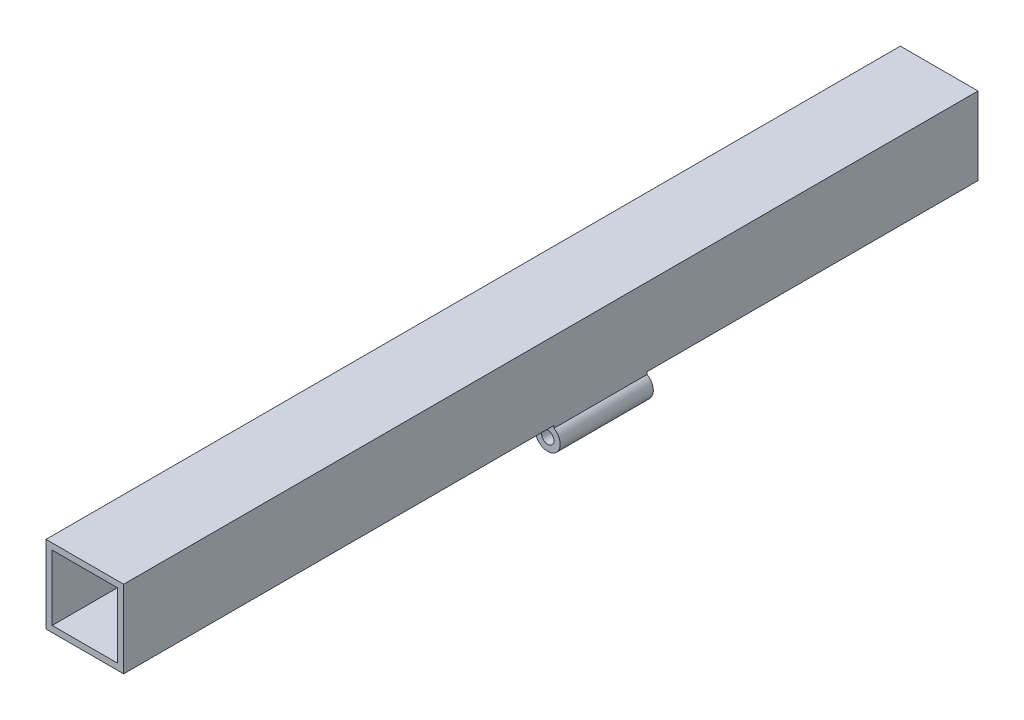
from build123d import *

# Parameters (mm, degrees)
SKETCH1_W           = 25
SKETCH1_H           = 25
SKETCH1_W_2         = 21
SKETCH1_H_2         = 21
BOSS_EXTRUDE1_DEPTH = 275
SKETCH2_R           = 2
BOSS_EXTRUDE2_DEPTH = 30


with BuildPart() as part:
    # Sketch1 → Boss-Extrude1 (new body)
    with BuildSketch(Plane.XY):
        Rectangle(SKETCH1_W, SKETCH1_H)
        Rectangle(SKETCH1_W_2, SKETCH1_H_2, mode=Mode.SUBTRACT)
    extrude(amount=BOSS_EXTRUDE1_DEPTH)

    # Sketch2 → Boss-Extrude2 (add)
    with BuildSketch(Plane.XY.offset(136.5)):
        with BuildLine():
            Line((12.5, -12.5), (12.5, -13.285898385))
            ThreePointArc((12.5, -13.285898385), (10.5, -20.75), (8.5, -13.285898385))
            Line((8.5, -13.285898385), (8.5, -12.5))
            Line((8.5, -12.5), (12.5, -12.5))
        make_face()
        with Locations((10.5, -16.75)):
            Circle(SKETCH2_R, mode=Mode.SUBTRACT)
    extrude(amount=-BOSS_EXTRUDE2_DEPTH)


solid = part.part
